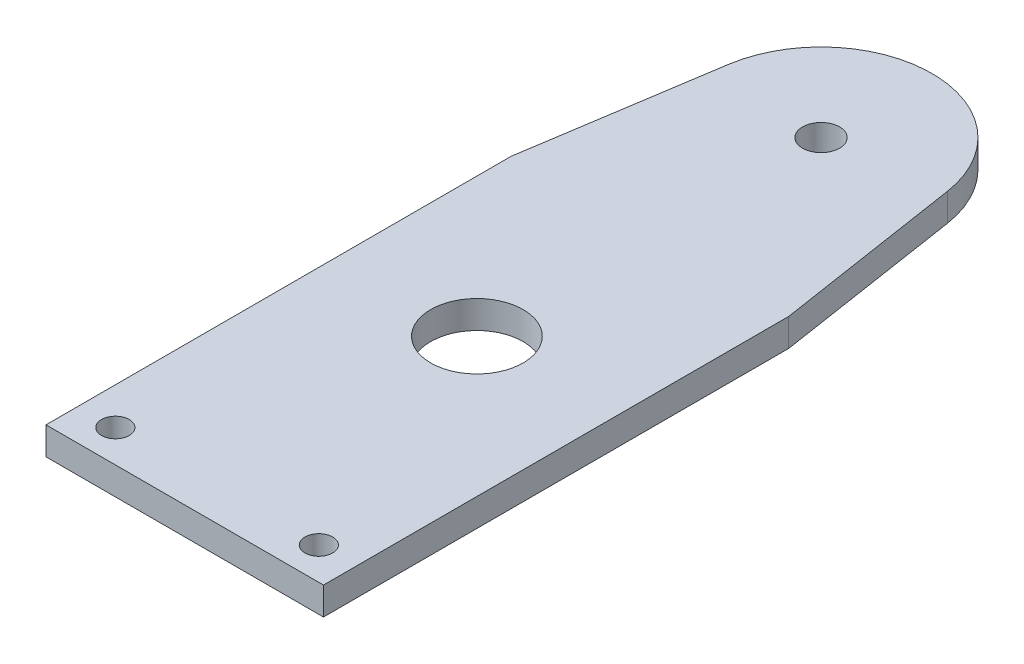
from build123d import *

# Parameters (mm, degrees)
SKETCH_1_R      = 1.5
SKETCH_1_R_2    = 2
SKETCH_1_R_3    = 5
EXTRUDE_1_DEPTH = 3


with BuildPart() as part:
    # Эскиз1 → Бобышка-Вытянуть1 (new body)
    with BuildSketch(Plane(origin=(0, 0, 0), x_dir=(1, 0, 0), z_dir=(0, 1, 0))):
        with BuildLine():
            Line((12.374772085, -29.617278809), (12.374772085, 20.682721191))
            Line((12.374772085, 20.682721191), (9.234119843, 41.014624779))
            ThreePointArc((9.234119843, 41.014624779), (-2.625227915, 51.182721191), (-14.484575673, 41.014624779))
            Line((-14.484575673, 41.014624779), (-17.625227915, 20.682721191))
            Line((-17.625227915, 20.682721191), (-17.625227915, -29.617278809))
            Line((-17.625227915, -29.617278809), (-10.625227915, -29.617278809))
            Line((-10.625227915, -29.617278809), (5.374772085, -29.617278809))
            Line((5.374772085, -29.617278809), (12.374772085, -29.617278809))
        make_face()
        with Locations(Location((-13.625227915, -26.117278809, 0), (0, 0, 270))):
            Circle(SKETCH_1_R, mode=Mode.SUBTRACT)
        with Locations(Location((8.374772085, -26.117278809, 0), (0, 0, 270))):
            Circle(SKETCH_1_R, mode=Mode.SUBTRACT)
        with Locations(Location((-2.625227915, 39.182721191, 0), (0, 0, 270))):
            Circle(SKETCH_1_R_2, mode=Mode.SUBTRACT)
        with Locations(Location((-2.625227915, 1.972721191, 0), (0, 0, 270))):
            Circle(SKETCH_1_R_3, mode=Mode.SUBTRACT)
    extrude(amount=EXTRUDE_1_DEPTH)


solid = part.part
